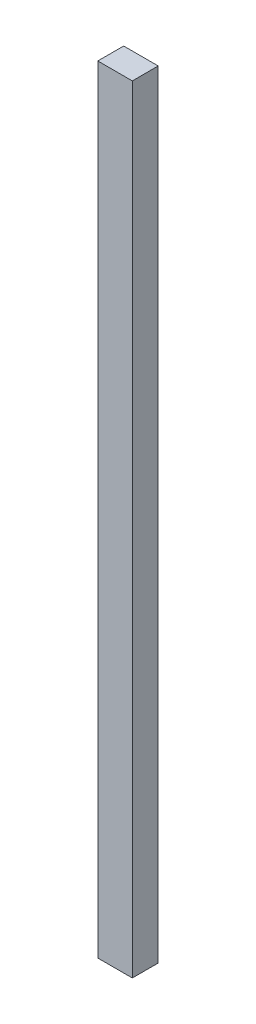
from build123d import *

# Parameters (mm, degrees)
SKETCH_1_W      = 4
SKETCH_1_H      = 90
EXTRUDE_1_DEPTH = 3


with BuildPart() as part:
    # 草图1 → 凸台-拉伸1 (new body)
    with BuildSketch(Plane.XY):
        with Locations((2, 45)):
            Rectangle(SKETCH_1_W, SKETCH_1_H)
    extrude(amount=EXTRUDE_1_DEPTH)


solid = part.part
